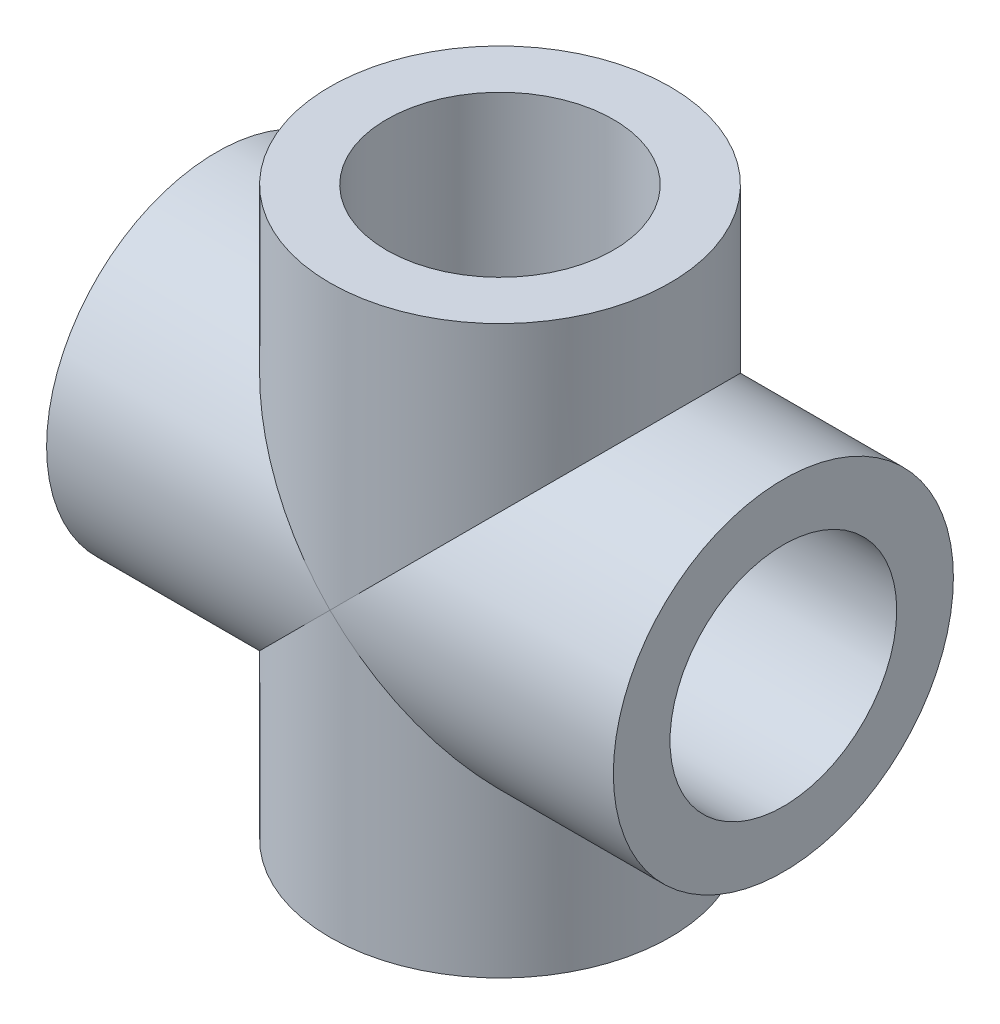
from build123d import *

# Parameters (mm, degrees)
SKETCH_1_R               = 15
SKETCH_1_R_2             = 10
EXTRUDE_1_DEPTH          = 50
EXTRUDE_6_DEPTH          = 25
EXTRUDE_6_DEPTH_BACK     = 25
SKETCH_9_R               = 15
CUT_EXTRUDE_2_DEPTH      = 25
CUT_EXTRUDE_2_DEPTH_BACK = 25
SKETCH_10_R              = 10
CUT_EXTRUDE_3_DEPTH      = 58.8791846
CUT_EXTRUDE_3_DEPTH_BACK = 58.8791846
SKETCH_11_R              = 10


with BuildPart() as part:
    # 草图1 → 凸台-拉伸1 (new body)
    with BuildSketch(Plane(origin=(0, 0, 0), x_dir=(1, 0, 0), z_dir=(0, 1, 0))):
        Circle(SKETCH_1_R)
        Circle(SKETCH_1_R_2, mode=Mode.SUBTRACT)
    extrude(amount=EXTRUDE_1_DEPTH)

    # 草图9 → 凸台-拉伸6 (add, two sides: drawn at the far end of the back side and taken through both)
    with BuildSketch(Plane(origin=(0, 0, 0), x_dir=(0, 0, -1), z_dir=(1, 0, 0)).offset(-EXTRUDE_6_DEPTH_BACK)):
        with Locations((0, 25)):
            Circle(SKETCH_9_R)
    extrude(amount=EXTRUDE_6_DEPTH + EXTRUDE_6_DEPTH_BACK)

    # 草图10 → 切除-拉伸2 (cut, two sides: drawn at the far end of the back side and taken through both)
    with BuildSketch(Plane(origin=(0, 0, 0), x_dir=(0, 0, -1), z_dir=(1, 0, 0)).offset(-CUT_EXTRUDE_2_DEPTH_BACK)):
        with Locations((0, 25)):
            Circle(SKETCH_10_R)
    extrude(amount=CUT_EXTRUDE_2_DEPTH + CUT_EXTRUDE_2_DEPTH_BACK, mode=Mode.SUBTRACT)

    # 草图11 → 切除-拉伸3 (cut, two sides: drawn at the far end of the back side and taken through both)
    with BuildSketch(Plane(origin=(0, 0, 0), x_dir=(1, 0, 0), z_dir=(0, 1, 0)).offset(-CUT_EXTRUDE_3_DEPTH_BACK)):
        Circle(SKETCH_11_R)
    extrude(amount=CUT_EXTRUDE_3_DEPTH + CUT_EXTRUDE_3_DEPTH_BACK, mode=Mode.SUBTRACT)


solid = part.part
